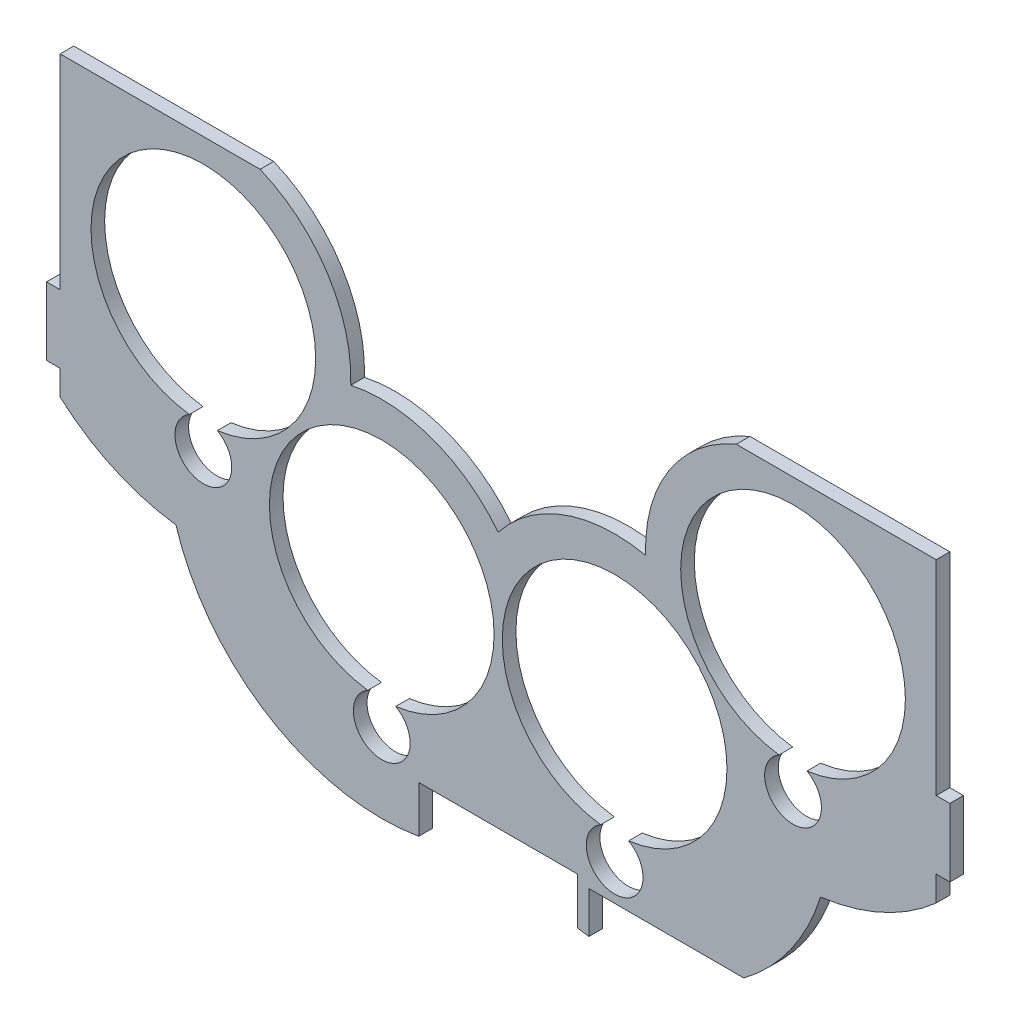
from build123d import *

# Parameters (mm, degrees)
EXTRUDE_1_DEPTH = 6


with BuildPart() as part:
    # Эскиз1 → Бобышка-Вытянуть1 (new body)
    with BuildSketch(Plane.XY):
        with BuildLine():
            Line((424, 250), (424, 160))
            Line((424, 160), (430, 160))
            Line((430, 160), (430, 130))
            Line((430, 130), (424, 130))
            Line((424, 130), (424, 118.979785419))
            ThreePointArc((424, 118.979785419), (400.249049588, 103.530628738), (372.998295097, 95.773021676))
            ThreePointArc((372.998295097, 95.773021676), (359.88843335, 69.223630945), (339.241493801, 48))
            Line((339.241493801, 48), (271, 48))
            Line((271, 48), (271, 29.720915629))
            ThreePointArc((271, 29.720915629), (268.495114821, 30.054927971), (266, 30.455447679))
            Line((266, 30.455447679), (266, 51))
            Line((266, 51), (196, 51))
            Line((196, 51), (196, 30.455447679))
            ThreePointArc((196, 30.455447679), (130.198007186, 42.960646788), (89.001704904, 95.773021676))
            ThreePointArc((89.001704904, 95.773021676), (61.750950412, 103.530628738), (38, 118.979785419))
            Line((38, 118.979785419), (38, 130))
            Line((38, 130), (32, 130))
            Line((32, 130), (32, 160))
            Line((32, 160), (38, 160))
            Line((38, 160), (38, 250))
            Line((38, 250), (126.096189432, 250))
            ThreePointArc((126.096189432, 250), (155.836604626, 225.049778093), (166.051782667, 187.59772866))
            ThreePointArc((166.051782667, 187.59772866), (201.928287817, 185.126127233), (231, 163.958510782))
            ThreePointArc((231, 163.958510782), (260.071712183, 185.126127233), (295.948217333, 187.59772866))
            ThreePointArc((295.948217333, 187.59772866), (306.163395374, 225.049778093), (335.903810568, 250))
            Line((335.903810568, 250), (424, 250))
        make_face()
        with BuildLine():
            ThreePointArc((107.24460838, 140.883333333), (101.096189432, 239.5), (94.947770485, 140.883333333))
            ThreePointArc((94.947770485, 140.883333333), (101.096189432, 117.5), (107.24460838, 140.883333333))
        make_face(mode=Mode.SUBTRACT)
        with BuildLine():
            ThreePointArc((185.845397449, 74.929440215), (179.696978501, 173.546106882), (173.548559554, 74.929440215))
            ThreePointArc((173.548559554, 74.929440215), (179.696978501, 51.546106882), (185.845397449, 74.929440215))
        make_face(mode=Mode.SUBTRACT)
        with BuildLine():
            ThreePointArc((288.451440446, 74.929440215), (282.303021499, 173.546106882), (276.154602551, 74.929440215))
            ThreePointArc((276.154602551, 74.929440215), (282.303021499, 51.546106882), (288.451440446, 74.929440215))
        make_face(mode=Mode.SUBTRACT)
        with BuildLine():
            ThreePointArc((367.052229515, 140.883333333), (360.903810568, 239.5), (354.75539162, 140.883333333))
            ThreePointArc((354.75539162, 140.883333333), (360.903810568, 117.5), (367.052229515, 140.883333333))
        make_face(mode=Mode.SUBTRACT)
    extrude(amount=EXTRUDE_1_DEPTH)


solid = part.part
